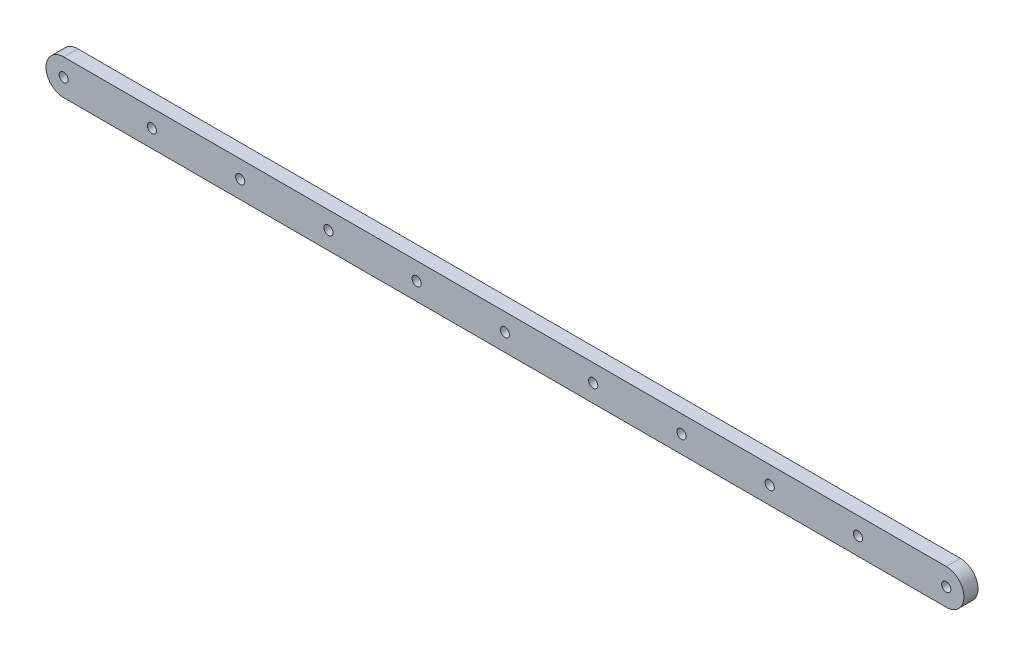
from build123d import *

# Parameters (mm, degrees)
SKETCH1_R           = 5
BOSS_EXTRUDE1_DEPTH = 4
SKETCH2_R           = 1.3
CUT_EXTRUDE1_DEPTH  = 256.080379489
LPATTERN1_COUNT     = 10
LPATTERN1_PITCH     = 25


with BuildPart() as part:
    # Sketch1 → Boss-Extrude1 (new body)
    with BuildSketch(Plane.XY):
        with BuildLine():
            Line((250, 5), (0, 5))
            ThreePointArc((0, 5), (3.535533906, 3.535533906), (5, 0))
            ThreePointArc((5, 0), (3.535533906, -3.535533906), (0, -5))
            Line((0, -5), (250, -5))
            ThreePointArc((250, -5), (245, 0), (250, 5))
        make_face()
        with Locations((250, 0)):
            Circle(SKETCH1_R)
        Circle(SKETCH1_R)
    extrude(amount=BOSS_EXTRUDE1_DEPTH)

    # Sketch2 → Cut-Extrude1 (cut, through all)
    with BuildSketch(Plane.XY.offset(4)):
        Circle(SKETCH2_R)
        with Locations((250, 0)):
            Circle(SKETCH2_R)
    cut_extrude1 = extrude(amount=-CUT_EXTRUDE1_DEPTH, mode=Mode.SUBTRACT)

    # LPattern1: Cut-Extrude1 ×10
    with Locations(*[(i * LPATTERN1_PITCH, 0, 0) for i in range(1, LPATTERN1_COUNT)]):
        add(cut_extrude1, mode=Mode.SUBTRACT)


solid = part.part
